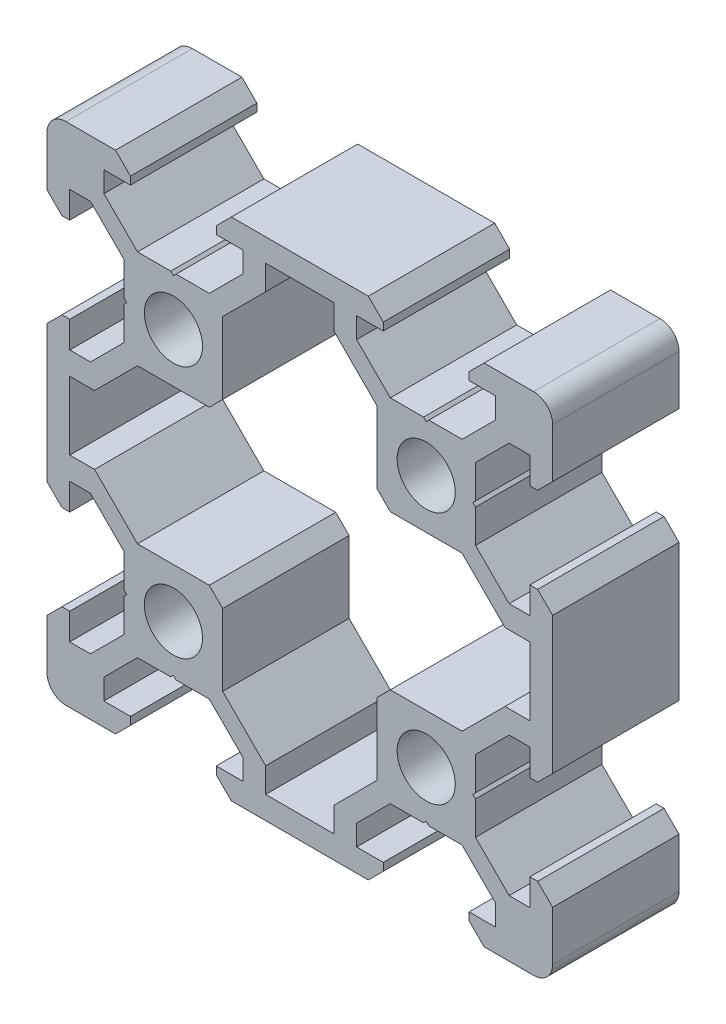
from build123d import *

# Parameters (mm, degrees)
SKETCH1_R           = 2.3
BOSS_EXTRUDE1_DEPTH = 10


with BuildPart() as part:
    # Sketch1 → Boss-Extrude1 (new body)
    with BuildSketch(Plane.XY):
        with BuildLine():
            Line((14.271948898, -9.838051102), (14.061948898, -9.628051102))
            Line((14.061948898, -9.628051102), (14.271948898, -9.418051102))
            Line((14.271948898, -9.418051102), (14.271948898, -6.788711274))
            Line((14.271948898, -6.788711274), (16.932609069, -4.128051102))
            Line((16.932609069, -4.128051102), (18.571948898, -4.128051102))
            Line((18.571948898, -4.128051102), (18.571948898, -6.233051102))
            Line((18.571948898, -6.233051102), (19.186948898, -6.233051102))
            Line((19.186948898, -6.233051102), (20.371948898, -5.048051102))
            Line((20.371948898, -5.048051102), (20.371948898, 5.791948898))
            Line((20.371948898, 5.791948898), (19.186948898, 6.976948898))
            Line((19.186948898, 6.976948898), (18.571948898, 6.976948898))
            Line((18.571948898, 6.976948898), (18.571948898, 4.871948898))
            Line((18.571948898, 4.871948898), (16.932609069, 4.871948898))
            Line((16.932609069, 4.871948898), (14.271948898, 7.532609069))
            Line((14.271948898, 7.532609069), (14.271948898, 10.161948898))
            Line((14.271948898, 10.161948898), (14.061948898, 10.371948898))
            Line((14.061948898, 10.371948898), (14.271948898, 10.581948898))
            Line((14.271948898, 10.581948898), (14.271948898, 13.211288726))
            Line((14.271948898, 13.211288726), (16.932609069, 15.871948898))
            Line((16.932609069, 15.871948898), (18.571948898, 15.871948898))
            Line((18.571948898, 15.871948898), (18.571948898, 13.766948898))
            Line((18.571948898, 13.766948898), (19.186948898, 13.766948898))
            Line((19.186948898, 13.766948898), (20.371948898, 14.951948898))
            Line((20.371948898, 14.951948898), (20.371948898, 18.871948898))
            ThreePointArc((20.371948898, 18.871948898), (19.932609069, 19.932609069), (18.871948898, 20.371948898))
            Line((18.871948898, 20.371948898), (14.951948898, 20.371948898))
            Line((14.951948898, 20.371948898), (13.766948898, 19.186948898))
            Line((13.766948898, 19.186948898), (13.766948898, 18.571948898))
            Line((13.766948898, 18.571948898), (15.871948898, 18.571948898))
            Line((15.871948898, 18.571948898), (15.871948898, 16.932609069))
            Line((15.871948898, 16.932609069), (13.211288726, 14.271948898))
            Line((13.211288726, 14.271948898), (10.581948898, 14.271948898))
            Line((10.581948898, 14.271948898), (10.371948898, 14.061948898))
            Line((10.371948898, 14.061948898), (10.161948898, 14.271948898))
            Line((10.161948898, 14.271948898), (7.532609069, 14.271948898))
            Line((7.532609069, 14.271948898), (4.871948898, 16.932609069))
            Line((4.871948898, 16.932609069), (4.871948898, 18.571948898))
            Line((4.871948898, 18.571948898), (6.976948898, 18.571948898))
            Line((6.976948898, 18.571948898), (6.976948898, 19.186948898))
            Line((6.976948898, 19.186948898), (5.791948898, 20.371948898))
            Line((5.791948898, 20.371948898), (-5.048051102, 20.371948898))
            Line((-5.048051102, 20.371948898), (-6.233051102, 19.186948898))
            Line((-6.233051102, 19.186948898), (-6.233051102, 18.571948898))
            Line((-6.233051102, 18.571948898), (-4.128051102, 18.571948898))
            Line((-4.128051102, 18.571948898), (-4.128051102, 16.932609069))
            Line((-4.128051102, 16.932609069), (-6.788711274, 14.271948898))
            Line((-6.788711274, 14.271948898), (-9.418051102, 14.271948898))
            Line((-9.418051102, 14.271948898), (-9.628051102, 14.061948898))
            Line((-9.628051102, 14.061948898), (-9.838051102, 14.271948898))
            Line((-9.838051102, 14.271948898), (-12.467390931, 14.271948898))
            Line((-12.467390931, 14.271948898), (-15.128051102, 16.932609069))
            Line((-15.128051102, 16.932609069), (-15.128051102, 18.571948898))
            Line((-15.128051102, 18.571948898), (-13.023051102, 18.571948898))
            Line((-13.023051102, 18.571948898), (-13.023051102, 19.186948898))
            Line((-13.023051102, 19.186948898), (-14.208051102, 20.371948898))
            Line((-14.208051102, 20.371948898), (-18.128051102, 20.371948898))
            ThreePointArc((-18.128051102, 20.371948898), (-19.188711274, 19.932609069), (-19.628051102, 18.871948898))
            Line((-19.628051102, 18.871948898), (-19.628051102, 14.951948898))
            Line((-19.628051102, 14.951948898), (-18.443051102, 13.766948898))
            Line((-18.443051102, 13.766948898), (-17.828051102, 13.766948898))
            Line((-17.828051102, 13.766948898), (-17.828051102, 15.871948898))
            Line((-17.828051102, 15.871948898), (-16.188711274, 15.871948898))
            Line((-16.188711274, 15.871948898), (-13.528051102, 13.211288726))
            Line((-13.528051102, 13.211288726), (-13.528051102, 10.581948898))
            Line((-13.528051102, 10.581948898), (-13.318051102, 10.371948898))
            Line((-13.318051102, 10.371948898), (-13.528051102, 10.161948898))
            Line((-13.528051102, 10.161948898), (-13.528051102, 7.532609069))
            Line((-13.528051102, 7.532609069), (-16.188711274, 4.871948898))
            Line((-16.188711274, 4.871948898), (-17.828051102, 4.871948898))
            Line((-17.828051102, 4.871948898), (-17.828051102, 6.976948898))
            Line((-17.828051102, 6.976948898), (-18.443051102, 6.976948898))
            Line((-18.443051102, 6.976948898), (-19.628051102, 5.791948898))
            Line((-19.628051102, 5.791948898), (-19.628051102, -5.048051102))
            Line((-19.628051102, -5.048051102), (-18.443051102, -6.233051102))
            Line((-18.443051102, -6.233051102), (-17.828051102, -6.233051102))
            Line((-17.828051102, -6.233051102), (-17.828051102, -4.128051102))
            Line((-17.828051102, -4.128051102), (-16.188711274, -4.128051102))
            Line((-16.188711274, -4.128051102), (-13.528051102, -6.788711274))
            Line((-13.528051102, -6.788711274), (-13.528051102, -9.418051102))
            Line((-13.528051102, -9.418051102), (-13.318051102, -9.628051102))
            Line((-13.318051102, -9.628051102), (-13.528051102, -9.838051102))
            Line((-13.528051102, -9.838051102), (-13.528051102, -12.467390931))
            Line((-13.528051102, -12.467390931), (-16.188711274, -15.128051102))
            Line((-16.188711274, -15.128051102), (-17.828051102, -15.128051102))
            Line((-17.828051102, -15.128051102), (-17.828051102, -13.023051102))
            Line((-17.828051102, -13.023051102), (-18.443051102, -13.023051102))
            Line((-18.443051102, -13.023051102), (-19.628051102, -14.208051102))
            Line((-19.628051102, -14.208051102), (-19.628051102, -18.128051102))
            ThreePointArc((-19.628051102, -18.128051102), (-19.188711274, -19.188711274), (-18.128051102, -19.628051102))
            Line((-18.128051102, -19.628051102), (-14.208051102, -19.628051102))
            Line((-14.208051102, -19.628051102), (-13.023051102, -18.443051102))
            Line((-13.023051102, -18.443051102), (-13.023051102, -17.828051102))
            Line((-13.023051102, -17.828051102), (-15.128051102, -17.828051102))
            Line((-15.128051102, -17.828051102), (-15.128051102, -16.188711274))
            Line((-15.128051102, -16.188711274), (-12.467390931, -13.528051102))
            Line((-12.467390931, -13.528051102), (-9.838051102, -13.528051102))
            Line((-9.838051102, -13.528051102), (-9.628051102, -13.318051102))
            Line((-9.628051102, -13.318051102), (-9.418051102, -13.528051102))
            Line((-9.418051102, -13.528051102), (-6.788711274, -13.528051102))
            Line((-6.788711274, -13.528051102), (-4.128051102, -16.188711274))
            Line((-4.128051102, -16.188711274), (-4.128051102, -17.828051102))
            Line((-4.128051102, -17.828051102), (-6.233051102, -17.828051102))
            Line((-6.233051102, -17.828051102), (-6.233051102, -18.443051102))
            Line((-6.233051102, -18.443051102), (-5.048051102, -19.628051102))
            Line((-5.048051102, -19.628051102), (5.791948898, -19.628051102))
            Line((5.791948898, -19.628051102), (6.976948898, -18.443051102))
            Line((6.976948898, -18.443051102), (6.976948898, -17.828051102))
            Line((6.976948898, -17.828051102), (4.871948898, -17.828051102))
            Line((4.871948898, -17.828051102), (4.871948898, -16.188711274))
            Line((4.871948898, -16.188711274), (7.532609069, -13.528051102))
            Line((7.532609069, -13.528051102), (10.161948898, -13.528051102))
            Line((10.161948898, -13.528051102), (10.371948898, -13.318051102))
            Line((10.371948898, -13.318051102), (10.581948898, -13.528051102))
            Line((10.581948898, -13.528051102), (13.211288726, -13.528051102))
            Line((13.211288726, -13.528051102), (15.871948898, -16.188711274))
            Line((15.871948898, -16.188711274), (15.871948898, -17.828051102))
            Line((15.871948898, -17.828051102), (13.766948898, -17.828051102))
            Line((13.766948898, -17.828051102), (13.766948898, -18.443051102))
            Line((13.766948898, -18.443051102), (14.951948898, -19.628051102))
            Line((14.951948898, -19.628051102), (18.871948898, -19.628051102))
            ThreePointArc((18.871948898, -19.628051102), (19.932609069, -19.188711274), (20.371948898, -18.128051102))
            Line((20.371948898, -18.128051102), (20.371948898, -14.208051102))
            Line((20.371948898, -14.208051102), (19.186948898, -13.023051102))
            Line((19.186948898, -13.023051102), (18.571948898, -13.023051102))
            Line((18.571948898, -13.023051102), (18.571948898, -15.128051102))
            Line((18.571948898, -15.128051102), (16.932609069, -15.128051102))
            Line((16.932609069, -15.128051102), (14.271948898, -12.467390931))
            Line((14.271948898, -12.467390931), (14.271948898, -9.838051102))
        make_face()
        with Locations((-9.628051102, -9.628051102)):
            Circle(SKETCH1_R, mode=Mode.SUBTRACT)
        with Locations((10.371948898, -9.628051102)):
            Circle(SKETCH1_R, mode=Mode.SUBTRACT)
        with Locations((10.371948898, 10.371948898)):
            Circle(SKETCH1_R, mode=Mode.SUBTRACT)
        with Locations((-9.628051102, 10.371948898)):
            Circle(SKETCH1_R, mode=Mode.SUBTRACT)
        Polygon((-12.467390931, 6.471948898), (-6.788711274, 6.471948898), (-5.728051102, 7.532609069), (-5.728051102, 13.211288726), (-2.328051102, 16.611288726), (-2.328051102, 18.571948898), (3.071948898, 18.571948898), (3.071948898, 16.611288726), (6.471948898, 13.211288726), (6.471948898, 7.532609069), (7.532609069, 6.471948898), (13.211288726, 6.471948898), (16.611288726, 3.071948898), (18.571948898, 3.071948898), (18.571948898, -2.328051102), (16.611288726, -2.328051102), (13.211288726, -5.728051102), (7.532609069, -5.728051102), (6.471948898, -6.788711274), (6.471948898, -12.467390931), (3.071948898, -15.867390931), (3.071948898, -17.828051102), (-2.328051102, -17.828051102), (-2.328051102, -15.867390931), (-5.728051102, -12.467390931), (-5.728051102, -6.788711274), (-6.788711274, -5.728051102), (-12.467390931, -5.728051102), (-15.867390931, -2.328051102), (-17.828051102, -2.328051102), (-17.828051102, 3.071948898), (-15.867390931, 3.071948898), align=None, mode=Mode.SUBTRACT)
    extrude(amount=BOSS_EXTRUDE1_DEPTH)


solid = part.part
